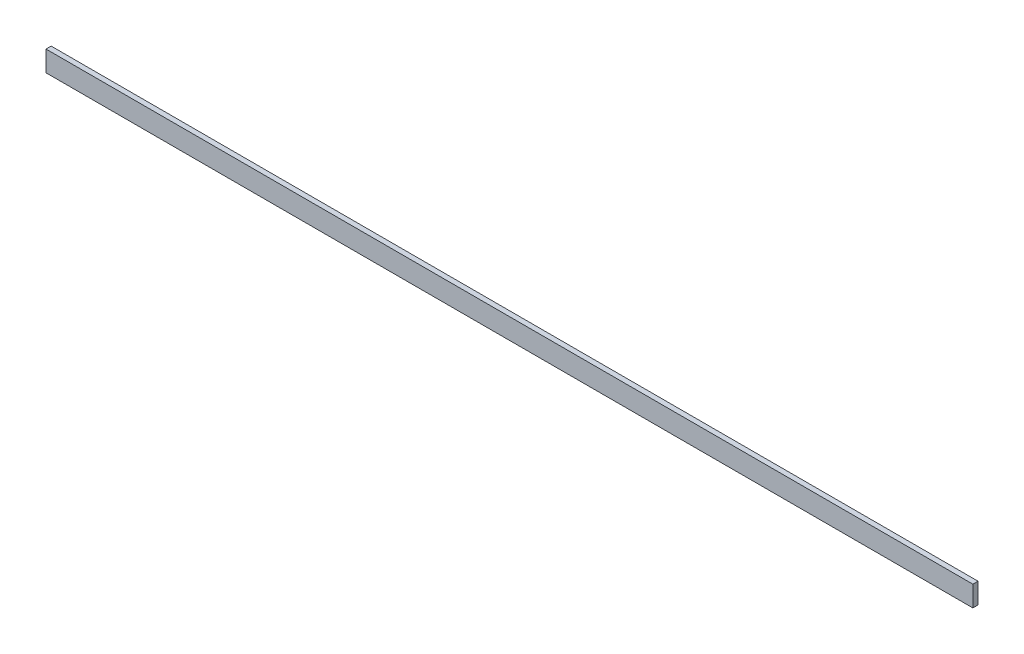
from build123d import *

# Parameters (mm, degrees)
SKETCH1_W           = 457.2
SKETCH1_H           = 10.16
BOSS_EXTRUDE1_DEPTH = 2.54
SKETCH2_R           = 3.175
BOSS_EXTRUDE2_DEPTH = 1.27
LPATTERN1_COUNT     = 23
LPATTERN1_PITCH     = 19.05


with BuildPart() as part:
    # Sketch1 → Boss-Extrude1 (new body)
    with BuildSketch(Plane.XY):
        with Locations((228.6, 5.08)):
            Rectangle(SKETCH1_W, SKETCH1_H)
    extrude(amount=BOSS_EXTRUDE1_DEPTH)

    # Sketch2 → Boss-Extrude2 (add)
    with BuildSketch(Plane(origin=(0, 0, 0), x_dir=(-1, 0, 0), z_dir=(0, 0, -1))):
        with Locations((-447.675, 4.7625)):
            Circle(SKETCH2_R)
    boss_extrude2 = extrude(amount=BOSS_EXTRUDE2_DEPTH)

    # LPattern1: Boss-Extrude2 ×23
    with Locations(*[(-i * LPATTERN1_PITCH, 0, 0) for i in range(1, LPATTERN1_COUNT)]):
        add(boss_extrude2)


solid = part.part
